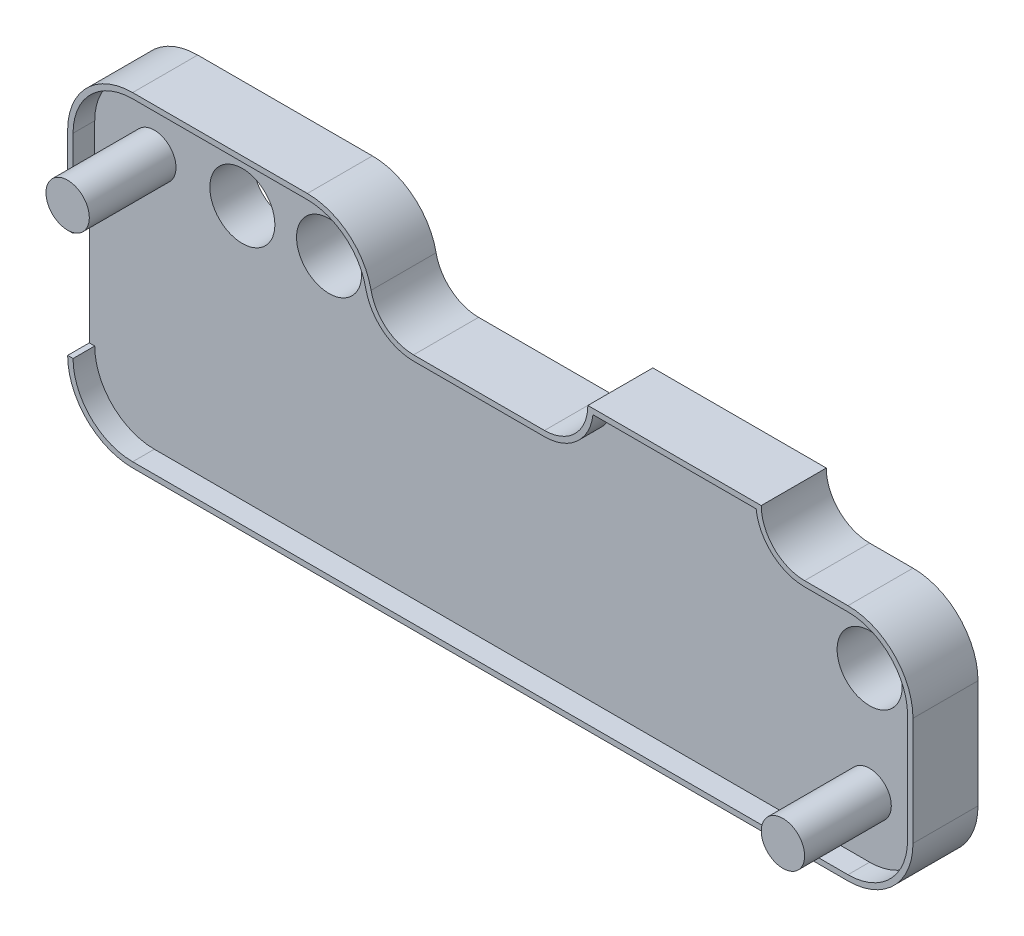
from build123d import *

# Parameters (mm, degrees)
SKETCH1_R           = 1
SKETCH1_R_2         = 1.5
BOSS_EXTRUDE1_DEPTH = 2
BOSS_EXTRUDE2_DEPTH = 3
SKETCH1_4_R         = 1
BOSS_EXTRUDE3_DEPTH = 6
SKETCH2_W           = 4
SKETCH2_H           = 5
CUT_EXTRUDE1_DEPTH  = 3


with BuildPart() as part:
    # Sketch1 → Boss-Extrude1 (new body)
    with BuildSketch(Plane.XY):
        with BuildLine():
            ThreePointArc((0.25, 3), (1.055456352, 1.055456352), (3, 0.25))
            Line((3, 0.25), (36, 0.25))
            ThreePointArc((36, 0.25), (37.944543648, 1.055456352), (38.75, 3))
            Line((38.75, 3), (38.75, 8))
            ThreePointArc((38.75, 8), (37.944543648, 9.944543648), (36, 10.75))
            Line((36, 10.75), (34, 10.75))
            ThreePointArc((34, 10.75), (32.5, 11.322949017), (31.763932023, 12.75))
            Line((31.763932023, 12.75), (24.236067977, 12.75))
            ThreePointArc((24.236067977, 12.75), (23.5, 11.322949017), (22, 10.75))
            Line((22, 10.75), (15.959591794, 10.75))
            ThreePointArc((15.959591794, 10.75), (14.536566847, 11.257157494), (13.755051026, 12.55))
            ThreePointArc((13.755051026, 12.55), (12.799865022, 14.13014084), (11.060612309, 14.75))
            Line((11.060612309, 14.75), (3, 14.75))
            ThreePointArc((3, 14.75), (1.055456352, 13.944543648), (0.25, 12))
            Line((0.25, 12), (0.25, 3))
        make_face()
        with Locations((36, 3)):
            Circle(SKETCH1_R, mode=Mode.SUBTRACT)
        with Locations((3, 12)):
            Circle(SKETCH1_R, mode=Mode.SUBTRACT)
        with Locations((7.060612309, 12)):
            Circle(SKETCH1_R_2, mode=Mode.SUBTRACT)
        with Locations((11.060612309, 12)):
            Circle(SKETCH1_R_2, mode=Mode.SUBTRACT)
        with Locations((36, 8)):
            Circle(SKETCH1_R_2, mode=Mode.SUBTRACT)
    extrude(amount=BOSS_EXTRUDE1_DEPTH)

    # Sketch1<3> → Boss-Extrude2 (add)
    with BuildSketch(Plane.XY):
        with BuildLine():
            Line((3, 0), (36, 0))
            ThreePointArc((36, 0), (38.121320344, 0.878679656), (39, 3))
            Line((39, 3), (39, 8))
            ThreePointArc((39, 8), (38.121320344, 10.121320344), (36, 11))
            Line((36, 11), (34, 11))
            ThreePointArc((34, 11), (32.585786438, 11.585786438), (32, 13))
            Line((32, 13), (24, 13))
            ThreePointArc((24, 13), (23.414213562, 11.585786438), (22, 11))
            Line((22, 11), (15.959591794, 11))
            ThreePointArc((15.959591794, 11), (14.69468073, 11.450806662), (14, 12.6))
            ThreePointArc((14, 12.6), (12.957978905, 14.323790008), (11.060612309, 15))
            Line((11.060612309, 15), (3, 15))
            ThreePointArc((3, 15), (0.878679656, 14.121320344), (0, 12))
            Line((0, 12), (0, 3))
            ThreePointArc((0, 3), (0.878679656, 0.878679656), (3, 0))
        make_face()
        with BuildLine():
            Line((3, 0.25), (36, 0.25))
            ThreePointArc((36, 0.25), (37.944543648, 1.055456352), (38.75, 3))
            Line((38.75, 3), (38.75, 8))
            ThreePointArc((38.75, 8), (37.944543648, 9.944543648), (36, 10.75))
            Line((36, 10.75), (34, 10.75))
            ThreePointArc((34, 10.75), (32.5, 11.322949017), (31.763932023, 12.75))
            Line((31.763932023, 12.75), (24.236067977, 12.75))
            ThreePointArc((24.236067977, 12.75), (23.5, 11.322949017), (22, 10.75))
            Line((22, 10.75), (15.959591794, 10.75))
            ThreePointArc((15.959591794, 10.75), (14.536566847, 11.257157494), (13.755051026, 12.55))
            ThreePointArc((13.755051026, 12.55), (12.799865022, 14.13014084), (11.060612309, 14.75))
            Line((11.060612309, 14.75), (3, 14.75))
            ThreePointArc((3, 14.75), (1.055456352, 13.944543648), (0.25, 12))
            Line((0.25, 12), (0.25, 3))
            ThreePointArc((0.25, 3), (1.055456352, 1.055456352), (3, 0.25))
        make_face(mode=Mode.SUBTRACT)
    extrude(amount=BOSS_EXTRUDE2_DEPTH)

    # Sketch1<4> → Boss-Extrude3 (add)
    with BuildSketch(Plane.XY):
        with Locations((3, 12)):
            Circle(SKETCH1_4_R)
        with Locations((36, 3)):
            Circle(SKETCH1_4_R)
    extrude(amount=BOSS_EXTRUDE3_DEPTH)

    # Sketch2 → Cut-Extrude1 (cut, symmetric)
    with BuildSketch(Plane.ZY):
        with Locations((4, 5.5)):
            Rectangle(SKETCH2_W, SKETCH2_H)
    extrude(amount=CUT_EXTRUDE1_DEPTH, both=True, mode=Mode.SUBTRACT)


solid = part.part
